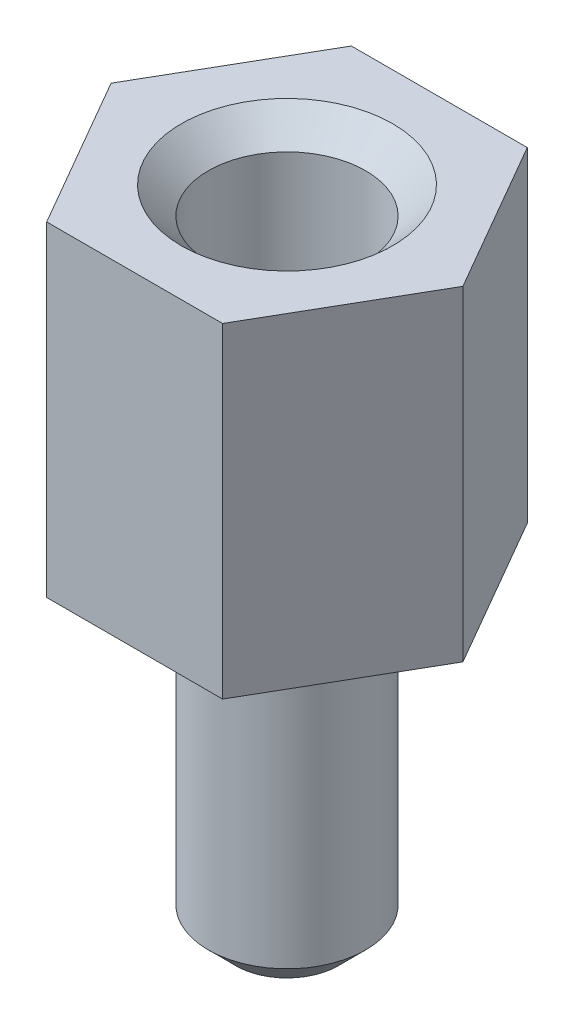
from build123d import *

# Parameters (mm, degrees)
BOSS_EXTRUDE1_DEPTH            = 6
SKETCH2_W                      = 1.45
SKETCH2_H                      = 6
F_2_9_2_9_DIAMETER_HOLE1_D     = 2.9
F_2_9_2_9_DIAMETER_HOLE1_DEPTH = 5
CHAMFER1_SIZE                  = 0.5


with BuildPart() as part:
    # Sketch1 → Boss-Extrude1 (new body)
    with BuildSketch(Plane(origin=(0, 6, 0), x_dir=(1, 0, 0), z_dir=(0, 1, 0))):
        Polygon((1.622354256, -2.81), (3.244708513, 0), (1.622354256, 2.81), (-1.622354256, 2.81), (-3.244708513, 0), (-1.622354256, -2.81), align=None)
    extrude(amount=-BOSS_EXTRUDE1_DEPTH)

    # Sketch2 → Revolve1 (revolve)
    with BuildSketch(Plane(origin=(0, 0, 0), x_dir=(-1, 0, 0), z_dir=(0, 0, -1)), mode=Mode.PRIVATE) as revolve1_sk:
        with Locations((-0.725, -3)):
            Rectangle(SKETCH2_W, SKETCH2_H)
    revolve(revolve1_sk.sketch.rotate(Axis((0, -6, 0), (0, 1, 0)), 270), axis=Axis((0, -6, 0), (0, 1, 0)))

    # Ø2.9 (2.9) Diameter Hole1
    with Locations(Plane(origin=(0, 6, 0), x_dir=(1, 0, 0), z_dir=(0, 1, 0))):
        with Locations((0, 0)):
            Hole(F_2_9_2_9_DIAMETER_HOLE1_D / 2, depth=F_2_9_2_9_DIAMETER_HOLE1_DEPTH)

    # Chamfer1
    chamfer1_edges = [part.edges().sort_by_distance(p)[0] for p in [
        (0, -6, -1.45),
        (1.45, 6, 0),
    ]]
    chamfer(chamfer1_edges, length=CHAMFER1_SIZE)


solid = part.part
